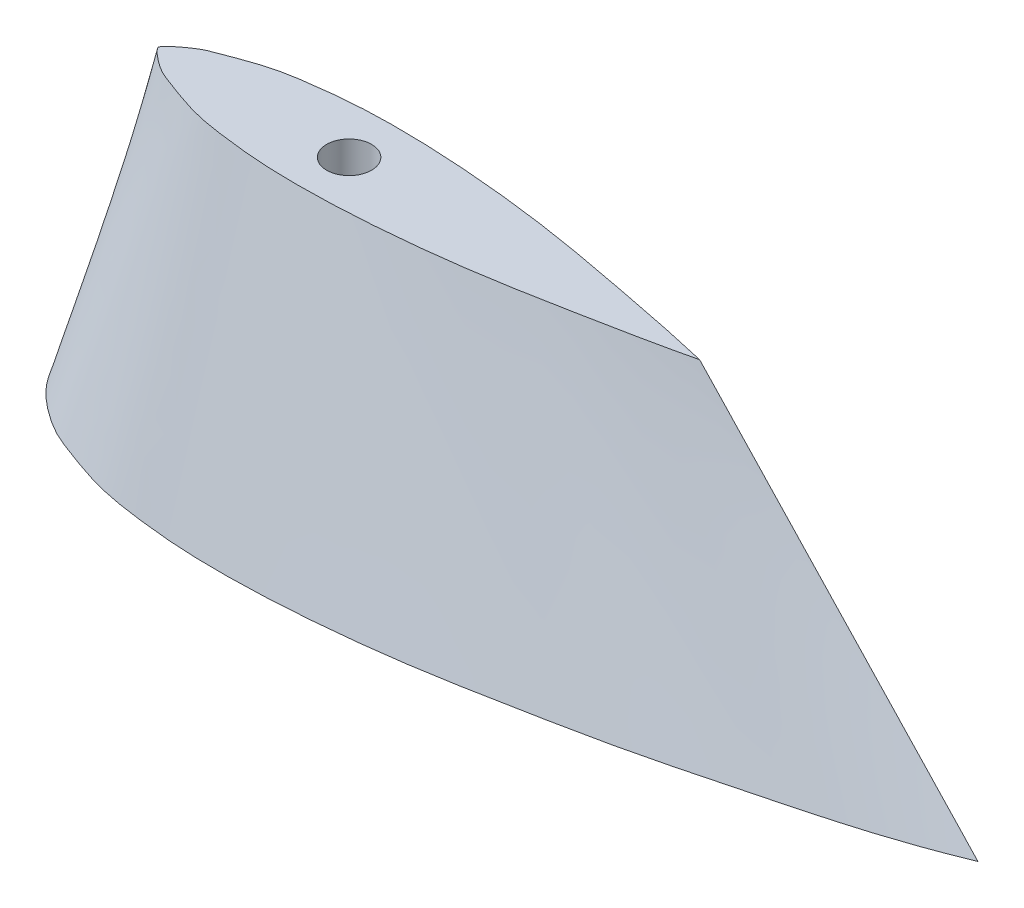
from build123d import *

# Parameters (mm, degrees)
SKETCH_3_R                    = 2
CUT_EXTRUDE_1_DEPTH           = 4
SKETCH_4_R                    = 1
CUT_EXTRUDE_2_DEPTH           = 4
CUT_EXTRUDE_3_DEPTH           = 1.5
SKETCH_7_W                    = 2
SKETCH_7_H                    = 1.5
CUT_REVOLVE_1_ANGLE           = 45
CUT_REVOLVE_1_OTHER_WAY_ANGLE = 45


with BuildPart() as part:
    # Эскиз1 → По сечениям1 section 0
    with BuildSketch(Plane(origin=(0, 0, 0), x_dir=(1, 0, 0), z_dir=(0, 1, 0))):
        with BuildLine():
            add(Edge.make_bspline(
                [(0, 0), (-0.026786257, 0.969360716), (0.61737566, 2.249301934), (1.974829337, 3.392775644), (2.993920842, 4.051952658), (4.355720519, 4.565101355), (5.990808256, 5.164346361), (8.017850303, 5.478919266), (10.008939201, 5.685410864), (12.675837367, 5.745020865), (16.011358195, 5.571319168), (20.019187774, 5.094065908), (23.99962122, 4.335399659), (28.002273256, 3.548249918), (31.989584978, 2.480873774), (36.034216793, 1.4621658), (38.689482894, 0.534654706), (39.98934, 0)],
                knots=[0, 0, 0, 0, 0.063515889, 0.095125078, 0.12262418, 0.147418569, 0.196010901, 0.243367076, 0.289416436, 0.335172983, 0.428593629, 0.521350126, 0.61548124, 0.710185536, 0.804793671, 0.902313957, 1, 1, 1, 1], degree=3))
            add(Edge.make_bspline(
                [(0, 0), (-0.026786257, -0.969360716), (0.61737566, -2.249301934), (1.974829337, -3.392775644), (2.993920842, -4.051952658), (4.355720519, -4.565101355), (5.990808256, -5.164346361), (8.017850303, -5.478919266), (10.008939201, -5.685410864), (12.675837367, -5.745020865), (16.011358195, -5.571319168), (20.019187774, -5.094065908), (23.99962122, -4.335399659), (28.002273256, -3.548249918), (31.989584978, -2.480873774), (36.034216793, -1.4621658), (38.689482894, -0.534654706), (39.98934, 0)],
                knots=[0, 0, 0, 0, 0.063515889, 0.095125078, 0.12262418, 0.147418569, 0.196010901, 0.243367076, 0.289416436, 0.335172983, 0.428593629, 0.521350126, 0.61548124, 0.710185536, 0.804793671, 0.902313957, 1, 1, 1, 1], degree=3))
        make_face()
    # Эскиз2 → По сечениям1 section 1
    with BuildSketch(Plane(origin=(0, 13.15, 0), x_dir=(1, 0, 0), z_dir=(0, 1, 0))):
        with BuildLine():
            add(Edge.make_bspline(
                [(27.600495608, 0), (26.597023876, 0.239787804), (25.590303432, 0.450633429), (24.07845351, 0.751139895), (23.574236087, 0.848926057), (22.565707302, 1.043661503), (22.061334673, 1.140064965), (20.547046456, 1.418849109), (19.535800832, 1.589380729), (17.506159089, 1.866741534), (16.488154051, 1.977054776), (14.445960524, 2.142594028), (13.421688191, 2.197073085), (11.878361295, 2.217156944), (11.362851505, 2.21434148), (10.328296524, 2.177214316), (9.808955229, 2.140264674), (9.027129396, 2.059771774), (8.766490273, 2.029170171), (8.246673774, 1.962396763), (7.98718809, 1.926435537), (7.470450481, 1.84090371), (7.213172633, 1.791491042), (6.703084975, 1.665443783), (6.451257898, 1.58763007), (5.953139588, 1.420127607), (5.706204125, 1.330156877), (5.336512255, 1.193117575), (5.213271138, 1.147312759), (4.967522086, 1.054347625), (4.844966339, 1.007283734), (4.485806342, 0.850578332), (4.26912101, 0.704612862), (3.95354488, 0.468428314), (3.84988299, 0.385871664), (3.704605146, 0.253019135), (3.657777639, 0.207183214), (3.570159407, 0.109650945), (3.528407556, 0.058887646), (3.495024534, 0)],
                knots=[0, 0, 0, 0, 0.125, 0.125, 0.1875, 0.1875, 0.25, 0.25, 0.375, 0.375, 0.5, 0.5, 0.625, 0.625, 0.6875, 0.6875, 0.75, 0.75, 0.78125, 0.78125, 0.8125, 0.8125, 0.84375, 0.84375, 0.875, 0.875, 0.90625, 0.90625, 0.921875, 0.921875, 0.9375, 0.9375, 0.96875, 0.96875, 0.984375, 0.984375, 0.9921875, 0.9921875, 1, 1, 1, 1], degree=3))
            add(Edge.make_bspline(
                [(3.495024534, 0), (3.527836487, -0.057880281), (3.570196415, -0.109749182), (3.658869962, -0.20834136), (3.70652894, -0.254882194), (3.853181237, -0.388672418), (3.956462947, -0.470726548), (4.167794949, -0.628660052), (4.275587446, -0.704873243), (4.499789963, -0.846140938), (4.615390753, -0.907467588), (4.853487439, -1.01062304), (4.974416307, -1.056988781), (5.216688696, -1.148571028), (5.338066313, -1.193693034), (5.702321862, -1.328718991), (5.945643298, -1.417393741), (6.436562197, -1.582891985), (6.684094371, -1.659896431), (7.189108296, -1.786329481), (7.445644373, -1.836258275), (7.9566654, -1.921867633), (8.212450695, -1.957701806), (8.724233006, -2.023999353), (8.980232008, -2.054412341), (9.748649974, -2.134972616), (10.261536754, -2.173252617), (11.288759593, -2.213048165), (11.802997519, -2.217053051), (13.346857368, -2.199994887), (14.378737253, -2.146921583), (16.440497768, -1.981978581), (17.466695193, -1.87149656), (19.509569182, -1.59358314), (20.525655422, -1.422620707), (22.045907717, -1.142986252), (22.552073866, -1.046277871), (23.564078812, -0.850903032), (24.070010899, -0.752794594), (25.586627068, -0.45141053), (26.595958245, -0.240042446), (27.600495608, 0)],
                knots=[0, 0, 0, 0, 0.0078125, 0.0078125, 0.015625, 0.015625, 0.03125, 0.03125, 0.046875, 0.046875, 0.0625, 0.0625, 0.078125, 0.078125, 0.09375, 0.09375, 0.125, 0.125, 0.15625, 0.15625, 0.1875, 0.1875, 0.21875, 0.21875, 0.25, 0.25, 0.3125, 0.3125, 0.375, 0.375, 0.5, 0.5, 0.625, 0.625, 0.75, 0.75, 0.8125, 0.8125, 0.875, 0.875, 1, 1, 1, 1], degree=3))
        make_face()
    loft()

    # Эскиз3 → Вырез-Вытянуть1 (cut)
    with BuildSketch(Plane(origin=(0, 0, 0), x_dir=(1, 0, 0), z_dir=(0, 1, 0))):
        with Locations((11.9968, 0)):
            Circle(SKETCH_3_R)
    extrude(amount=CUT_EXTRUDE_1_DEPTH, mode=Mode.SUBTRACT)

    # Эскиз4 → Вырез-Вытянуть2 (cut)
    with BuildSketch(Plane(origin=(0, 13.15, 0), x_dir=(1, 0, 0), z_dir=(0, 1, 0))):
        with Locations((11.9968, 0)):
            Circle(SKETCH_4_R)
    extrude(amount=-CUT_EXTRUDE_2_DEPTH, mode=Mode.SUBTRACT)

    # Эскиз5 → Вырез-Вытянуть3 (cut)
    with BuildSketch(Plane.XZ):
        Polygon((18.75, 1), (16.75, 1), (16.75, 0), (16.75, -1), (18.75, -1), align=None)
    extrude(amount=-CUT_EXTRUDE_3_DEPTH, mode=Mode.SUBTRACT)

    # Эскиз7 → Вырез-Повернуть1 (revolve, cut)
    with BuildSketch(Plane.XY):
        with Locations((17.75, 0.75)):
            Rectangle(SKETCH_7_W, SKETCH_7_H)
    revolve(axis=Axis((11.9968, 4, 0), (0, -1, 0)), revolution_arc=CUT_REVOLVE_1_ANGLE, mode=Mode.SUBTRACT)

    # Эскиз7 → Вырез-Повернуть1 other way (revolve, cut)
    with BuildSketch(Plane.XY):
        with Locations((17.75, 0.75)):
            Rectangle(SKETCH_7_W, SKETCH_7_H)
    revolve(axis=Axis((11.9968, 4, 0), (0, 1, 0)), revolution_arc=CUT_REVOLVE_1_OTHER_WAY_ANGLE, mode=Mode.SUBTRACT)


solid = part.part
